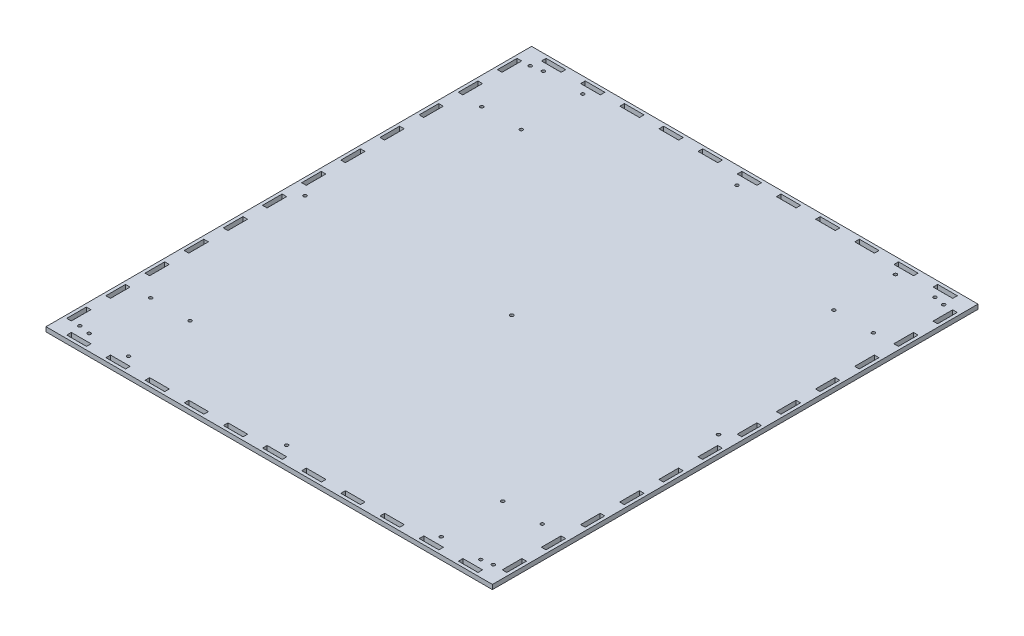
from build123d import *

# Parameters (mm, degrees)
SKETCH1_W           = 570
SKETCH1_H           = 620
SKETCH1_R           = 2.05
SKETCH1_R_2         = 2.1
SKETCH1_W_2         = 25.1
SKETCH1_H_2         = 5.85
SKETCH1_W_3         = 5.85
SKETCH1_H_3         = 25.1
BOSS_EXTRUDE1_DEPTH = 5.8


with BuildPart() as part:
    # Sketch1 → Boss-Extrude1 (new body)
    with BuildSketch(Plane(origin=(0, 0, 0), x_dir=(1, 0, 0), z_dir=(0, 1, 0))):
        Rectangle(SKETCH1_W, SKETCH1_H)
        with Locations(Location((250, 290, 0), (0, 0, 270))):
            Circle(SKETCH1_R, mode=Mode.SUBTRACT)
        with Locations(Location((250, -290, 0), (0, 0, 90))):
            Circle(SKETCH1_R, mode=Mode.SUBTRACT)
        with Locations(Location((-250, -290, 0), (0, 0, 270))):
            Circle(SKETCH1_R, mode=Mode.SUBTRACT)
        with Locations(Location((-250, 290, 0), (0, 0, 90))):
            Circle(SKETCH1_R, mode=Mode.SUBTRACT)
        with Locations(Location((-264.314516129, -287.5, 0), (0, 0, 270))):
            Circle(SKETCH1_R_2, mode=Mode.SUBTRACT)
        with Locations(Location((-0.314516129, -287.5, 0), (0, 0, 270))):
            Circle(SKETCH1_R_2, mode=Mode.SUBTRACT)
        with Locations(Location((263.685483871, -287.5, 0), (0, 0, 270))):
            Circle(SKETCH1_R_2, mode=Mode.SUBTRACT)
        with Locations(Location((-0.314516129, 0, 0), (0, 0, 270))):
            Circle(SKETCH1_R_2, mode=Mode.SUBTRACT)
        with Locations(Location((263.685483871, 0, 0), (0, 0, 270))):
            Circle(SKETCH1_R_2, mode=Mode.SUBTRACT)
        with Locations(Location((-0.314516129, 287.5, 0), (0, 0, 270))):
            Circle(SKETCH1_R_2, mode=Mode.SUBTRACT)
        with Locations(Location((263.685483871, 287.5, 0), (0, 0, 270))):
            Circle(SKETCH1_R_2, mode=Mode.SUBTRACT)
        with Locations(Location((-264.314516129, 0, 0), (0, 0, 270))):
            Circle(SKETCH1_R_2, mode=Mode.SUBTRACT)
        with Locations(Location((-264.314516129, 287.5, 0), (0, 0, 270))):
            Circle(SKETCH1_R_2, mode=Mode.SUBTRACT)
        with Locations(Location((-199.6, -290, 0), (0, 0, 270))):
            Circle(SKETCH1_R, mode=Mode.SUBTRACT)
        with Locations(Location((-199.6, -211.4, 0), (0, 0, 90))):
            Circle(SKETCH1_R, mode=Mode.SUBTRACT)
        with Locations(Location((-250, -211.4, 0), (0, 0, 90))):
            Circle(SKETCH1_R, mode=Mode.SUBTRACT)
        with Locations(Location((199.6, -290, 0), (0, 0, 270))):
            Circle(SKETCH1_R, mode=Mode.SUBTRACT)
        with Locations(Location((250, -211.4, 0), (0, 0, 270))):
            Circle(SKETCH1_R, mode=Mode.SUBTRACT)
        with Locations(Location((199.6, -211.4, 0), (0, 0, 90))):
            Circle(SKETCH1_R, mode=Mode.SUBTRACT)
        with Locations(Location((-250, 211.4, 0), (0, 0, 270))):
            Circle(SKETCH1_R, mode=Mode.SUBTRACT)
        with Locations(Location((-199.6, 211.4, 0), (0, 0, 270))):
            Circle(SKETCH1_R, mode=Mode.SUBTRACT)
        with Locations(Location((-199.6, 290, 0), (0, 0, 90))):
            Circle(SKETCH1_R, mode=Mode.SUBTRACT)
        with Locations(Location((199.6, 290, 0), (0, 0, 90))):
            Circle(SKETCH1_R, mode=Mode.SUBTRACT)
        with Locations(Location((250, 211.4, 0), (0, 0, 90))):
            Circle(SKETCH1_R, mode=Mode.SUBTRACT)
        with Locations(Location((199.6, 211.4, 0), (0, 0, 270))):
            Circle(SKETCH1_R, mode=Mode.SUBTRACT)
        with Locations((-199.95, 303.075)):
            Rectangle(SKETCH1_W_2, SKETCH1_H_2, mode=Mode.SUBTRACT)
        with Locations((-249.95, 303.075)):
            Rectangle(SKETCH1_W_2, SKETCH1_H_2, mode=Mode.SUBTRACT)
        with Locations((-149.95, 303.075)):
            Rectangle(SKETCH1_W_2, SKETCH1_H_2, mode=Mode.SUBTRACT)
        with Locations((-99.95, 303.075)):
            Rectangle(SKETCH1_W_2, SKETCH1_H_2, mode=Mode.SUBTRACT)
        with Locations((-49.95, 303.075)):
            Rectangle(SKETCH1_W_2, SKETCH1_H_2, mode=Mode.SUBTRACT)
        with Locations((0.05, 303.075)):
            Rectangle(SKETCH1_W_2, SKETCH1_H_2, mode=Mode.SUBTRACT)
        with Locations((50.05, 303.075)):
            Rectangle(SKETCH1_W_2, SKETCH1_H_2, mode=Mode.SUBTRACT)
        with Locations((100.05, 303.075)):
            Rectangle(SKETCH1_W_2, SKETCH1_H_2, mode=Mode.SUBTRACT)
        with Locations((150.05, 303.075)):
            Rectangle(SKETCH1_W_2, SKETCH1_H_2, mode=Mode.SUBTRACT)
        with Locations((200.05, 303.075)):
            Rectangle(SKETCH1_W_2, SKETCH1_H_2, mode=Mode.SUBTRACT)
        with Locations((250.05, 303.075)):
            Rectangle(SKETCH1_W_2, SKETCH1_H_2, mode=Mode.SUBTRACT)
        with Locations((250.05, -303.075)):
            Rectangle(SKETCH1_W_2, SKETCH1_H_2, mode=Mode.SUBTRACT)
        with Locations((200.05, -303.075)):
            Rectangle(SKETCH1_W_2, SKETCH1_H_2, mode=Mode.SUBTRACT)
        with Locations((150.05, -303.075)):
            Rectangle(SKETCH1_W_2, SKETCH1_H_2, mode=Mode.SUBTRACT)
        with Locations((100.05, -303.075)):
            Rectangle(SKETCH1_W_2, SKETCH1_H_2, mode=Mode.SUBTRACT)
        with Locations((50.05, -303.075)):
            Rectangle(SKETCH1_W_2, SKETCH1_H_2, mode=Mode.SUBTRACT)
        with Locations((0.05, -303.075)):
            Rectangle(SKETCH1_W_2, SKETCH1_H_2, mode=Mode.SUBTRACT)
        with Locations((-49.95, -303.075)):
            Rectangle(SKETCH1_W_2, SKETCH1_H_2, mode=Mode.SUBTRACT)
        with Locations((-99.95, -303.075)):
            Rectangle(SKETCH1_W_2, SKETCH1_H_2, mode=Mode.SUBTRACT)
        with Locations((-149.95, -303.075)):
            Rectangle(SKETCH1_W_2, SKETCH1_H_2, mode=Mode.SUBTRACT)
        with Locations((-199.95, -303.075)):
            Rectangle(SKETCH1_W_2, SKETCH1_H_2, mode=Mode.SUBTRACT)
        with Locations((-249.95, -303.075)):
            Rectangle(SKETCH1_W_2, SKETCH1_H_2, mode=Mode.SUBTRACT)
        with Locations((-278.075, 224.95)):
            Rectangle(SKETCH1_W_3, SKETCH1_H_3, mode=Mode.SUBTRACT)
        with Locations((-278.075, 274.95)):
            Rectangle(SKETCH1_W_3, SKETCH1_H_3, mode=Mode.SUBTRACT)
        with Locations((-278.075, 174.95)):
            Rectangle(SKETCH1_W_3, SKETCH1_H_3, mode=Mode.SUBTRACT)
        with Locations((-278.075, 124.95)):
            Rectangle(SKETCH1_W_3, SKETCH1_H_3, mode=Mode.SUBTRACT)
        with Locations((-278.075, 74.95)):
            Rectangle(SKETCH1_W_3, SKETCH1_H_3, mode=Mode.SUBTRACT)
        with Locations((-278.075, 24.95)):
            Rectangle(SKETCH1_W_3, SKETCH1_H_3, mode=Mode.SUBTRACT)
        with Locations((-278.075, -25.05)):
            Rectangle(SKETCH1_W_3, SKETCH1_H_3, mode=Mode.SUBTRACT)
        with Locations((-278.075, -75.05)):
            Rectangle(SKETCH1_W_3, SKETCH1_H_3, mode=Mode.SUBTRACT)
        with Locations((-278.075, -125.05)):
            Rectangle(SKETCH1_W_3, SKETCH1_H_3, mode=Mode.SUBTRACT)
        with Locations((-278.075, -175.05)):
            Rectangle(SKETCH1_W_3, SKETCH1_H_3, mode=Mode.SUBTRACT)
        with Locations((-278.075, -225.05)):
            Rectangle(SKETCH1_W_3, SKETCH1_H_3, mode=Mode.SUBTRACT)
        with Locations((-278.075, -275.05)):
            Rectangle(SKETCH1_W_3, SKETCH1_H_3, mode=Mode.SUBTRACT)
        with Locations((278.075, -275.05)):
            Rectangle(SKETCH1_W_3, SKETCH1_H_3, mode=Mode.SUBTRACT)
        with Locations((278.075, -225.05)):
            Rectangle(SKETCH1_W_3, SKETCH1_H_3, mode=Mode.SUBTRACT)
        with Locations((278.075, -175.05)):
            Rectangle(SKETCH1_W_3, SKETCH1_H_3, mode=Mode.SUBTRACT)
        with Locations((278.075, -125.05)):
            Rectangle(SKETCH1_W_3, SKETCH1_H_3, mode=Mode.SUBTRACT)
        with Locations((278.075, -75.05)):
            Rectangle(SKETCH1_W_3, SKETCH1_H_3, mode=Mode.SUBTRACT)
        with Locations((278.075, -25.05)):
            Rectangle(SKETCH1_W_3, SKETCH1_H_3, mode=Mode.SUBTRACT)
        with Locations((278.075, 24.95)):
            Rectangle(SKETCH1_W_3, SKETCH1_H_3, mode=Mode.SUBTRACT)
        with Locations((278.075, 74.95)):
            Rectangle(SKETCH1_W_3, SKETCH1_H_3, mode=Mode.SUBTRACT)
        with Locations((278.075, 124.95)):
            Rectangle(SKETCH1_W_3, SKETCH1_H_3, mode=Mode.SUBTRACT)
        with Locations((278.075, 174.95)):
            Rectangle(SKETCH1_W_3, SKETCH1_H_3, mode=Mode.SUBTRACT)
        with Locations((278.075, 224.95)):
            Rectangle(SKETCH1_W_3, SKETCH1_H_3, mode=Mode.SUBTRACT)
        with Locations((278.075, 274.95)):
            Rectangle(SKETCH1_W_3, SKETCH1_H_3, mode=Mode.SUBTRACT)
    extrude(amount=BOSS_EXTRUDE1_DEPTH)


solid = part.part
